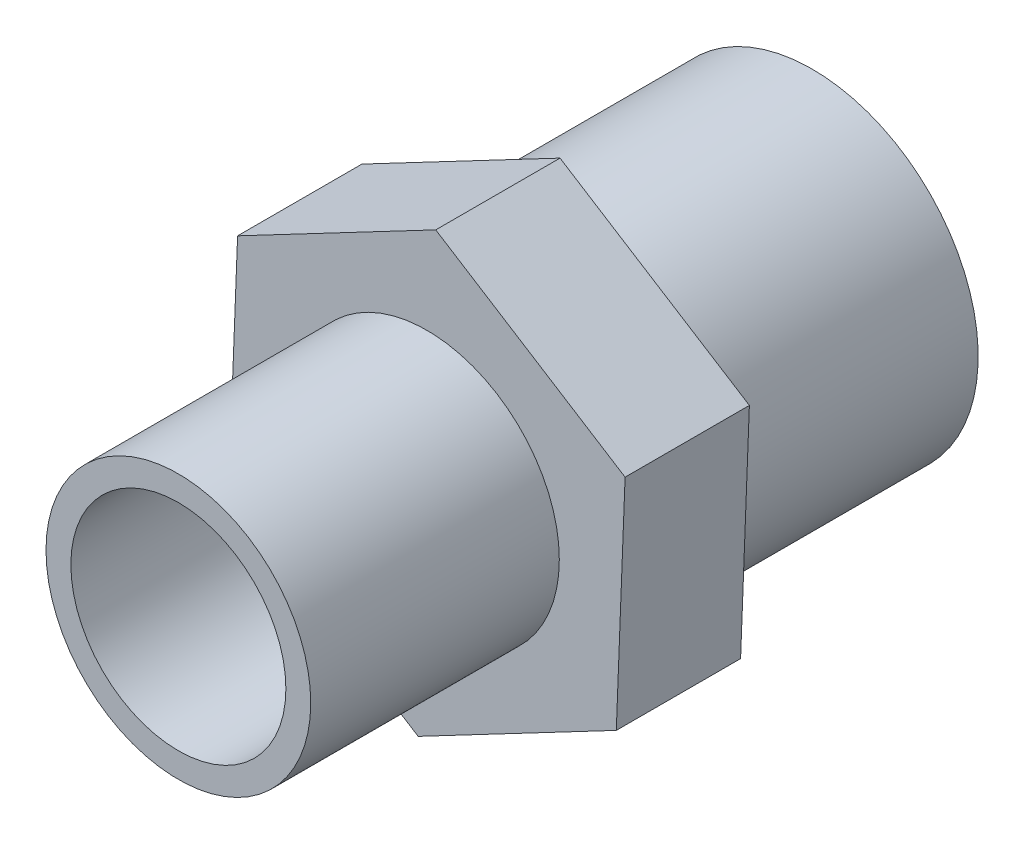
from build123d import *

# Parameters (mm, degrees)
SKETCH1_R           = 13.35
SKETCH1_R_2         = 11.35
EXTRUDE_THIN1_DEPTH = 13
BOSS_EXTRUDE1_DEPTH = 5
SKETCH3_R           = 10.65
SKETCH3_R_2         = 8.65
EXTRUDE_THIN2_DEPTH = 20


with BuildPart() as part:
    # Sketch1 → Extrude-Thin1 (new, symmetric)
    with BuildSketch(Plane.XY):
        Circle(SKETCH1_R)
        Circle(SKETCH1_R_2, mode=Mode.SUBTRACT)
    extrude(amount=EXTRUDE_THIN1_DEPTH, both=True)

    # Sketch2 → Boss-Extrude1 (add, symmetric)
    with BuildSketch(Plane.XY.offset(13)):
        Polygon((15.942171509, 8.387348964), (0.707428481, 18), (-15.234743028, 9.612651036), (-15.942171509, -8.387348964), (-0.707428481, -18), (15.234743028, -9.612651036), align=None)
    extrude(amount=BOSS_EXTRUDE1_DEPTH, both=True)

    # Sketch3 → Extrude-Thin2 (add)
    with BuildSketch(Plane.XY.offset(18)):
        Circle(SKETCH3_R)
        Circle(SKETCH3_R_2, mode=Mode.SUBTRACT)
    extrude(amount=EXTRUDE_THIN2_DEPTH)


solid = part.part
